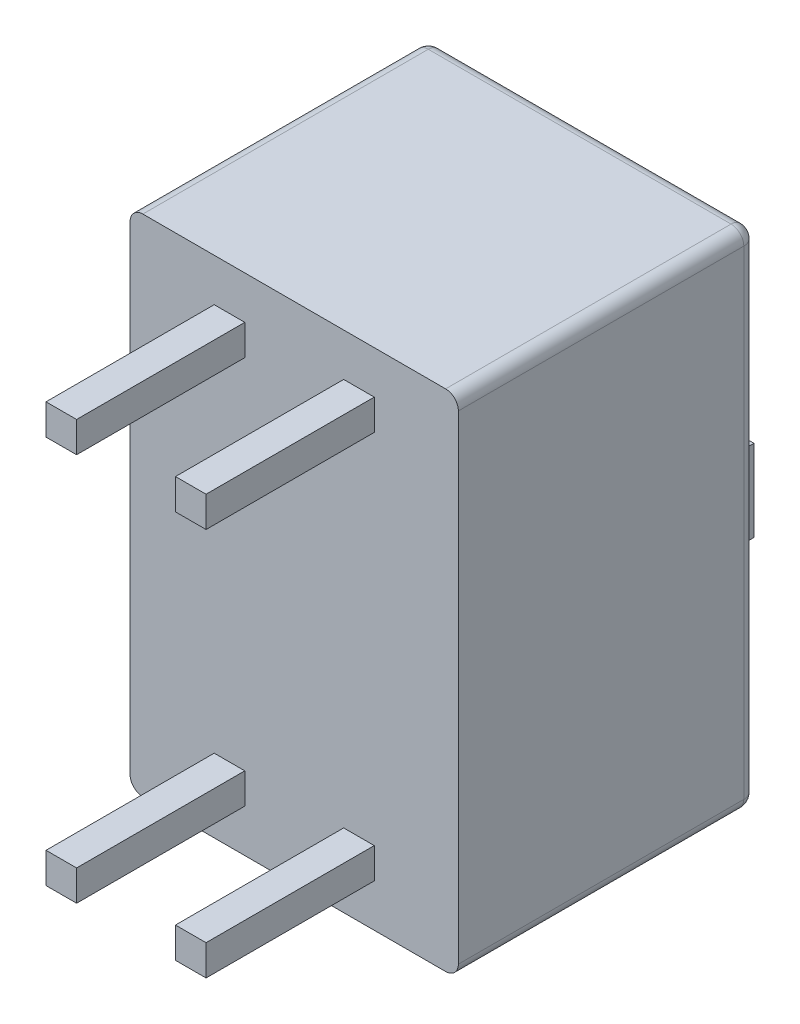
from build123d import *

# Parameters (mm, degrees)
IZIM1_W                       = 6.44
IZIM1_H                       = 9.9
Y_KSEKLIK_EKSTR_ZYON1_DEPTH   = 5.85
IZIM2_W                       = 1.4
IZIM2_H                       = 3.2
KES_EKSTR_ZYON1_DEPTH         = 1
IZIM4_W                       = 1.4
IZIM4_H                       = 1.6
Y_KSEKLIK_EKSTR_ZYON3_DEPTH   = 2.2
IZIM5_W                       = 1.4
IZIM5_H                       = 1.6
Y_KSEKLIK_EKSTR_ZYON4_DEPTH   = 0.9
Y_KSEKLIK_EKSTR_ZYON4_2_DEPTH = 0.9
RADYUS1_R                     = 0.25
IZIM6_W                       = 0.6
IZIM6_H                       = 0.6
Y_KSEKLIK_EKSTR_ZYON5_DEPTH   = 3.3


with BuildPart() as part:
    # Çizim1 → Yükseklik-Ekstrüzyon1 (new body)
    with BuildSketch(Plane.XY):
        Rectangle(IZIM1_W, IZIM1_H)
    extrude(amount=Y_KSEKLIK_EKSTR_ZYON1_DEPTH)

    # Çizim2 → Kes-Ekstrüzyon1 (cut)
    with BuildSketch(Plane(origin=(0, 0, 0), x_dir=(-1, 0, 0), z_dir=(0, 0, -1))):
        with Locations((-1.27, 0)):
            Rectangle(IZIM2_W, IZIM2_H)
        with Locations((1.27, 0)):
            Rectangle(IZIM2_W, IZIM2_H)
    extrude(amount=-KES_EKSTR_ZYON1_DEPTH, mode=Mode.SUBTRACT)

    # Çizim4 → Yükseklik-Ekstrüzyon3 (add)
    with BuildSketch(Plane(origin=(0, 0, 1), x_dir=(-1, 0, 0), z_dir=(0, 0, -1))):
        with Locations((-1.27, -0.8)):
            Rectangle(IZIM4_W, IZIM4_H)
        with Locations((1.27, -0.8)):
            Rectangle(IZIM4_W, IZIM4_H)
    extrude(amount=Y_KSEKLIK_EKSTR_ZYON3_DEPTH)

    # Radyus1
    radyus1_edges = [part.edges().sort_by_distance(p)[0] for p in [
        (0, -4.95, 0),
        (-3.22, 0, 0),
        (0, 4.95, 0),
        (3.22, 0, 0),
        (3.22, -4.95, 2.925),
        (-3.22, -4.95, 2.925),
        (-3.22, 4.95, 2.925),
        (3.22, 4.95, 2.925),
    ]]
    fillet(radyus1_edges, radius=RADYUS1_R)

    # Çizim6 → Yükseklik-Ekstrüzyon5 (add)
    with BuildSketch(Plane.XY.offset(5.85)):
        with Locations((1.27, -3.81)):
            Rectangle(IZIM6_W, IZIM6_H)
        with Locations((-1.27, -3.81)):
            Rectangle(IZIM6_W, IZIM6_H)
        with Locations((-1.27, 3.81)):
            Rectangle(IZIM6_W, IZIM6_H)
        with Locations((1.27, 3.81)):
            Rectangle(IZIM6_W, IZIM6_H)
    extrude(amount=Y_KSEKLIK_EKSTR_ZYON5_DEPTH)


with BuildPart() as body_2:
    # Çizim5 → Yükseklik-Ekstrüzyon4 (new body)
    with BuildSketch(Plane(origin=(0, 0, 1), x_dir=(-1, 0, 0), z_dir=(0, 0, -1))):
        with Locations((-1.27, 0.8)):
            Rectangle(IZIM5_W, IZIM5_H)
    extrude(amount=Y_KSEKLIK_EKSTR_ZYON4_DEPTH)


with BuildPart() as body_3:
    # Çizim5 → Y_kseklik-Ekstr_zyon4 2 (new body)
    with BuildSketch(Plane(origin=(0, 0, 1), x_dir=(-1, 0, 0), z_dir=(0, 0, -1))):
        with Locations((1.27, 0.8)):
            Rectangle(IZIM5_W, IZIM5_H)
    extrude(amount=Y_KSEKLIK_EKSTR_ZYON4_2_DEPTH)


solid = Compound([part.part, body_2.part, body_3.part])
